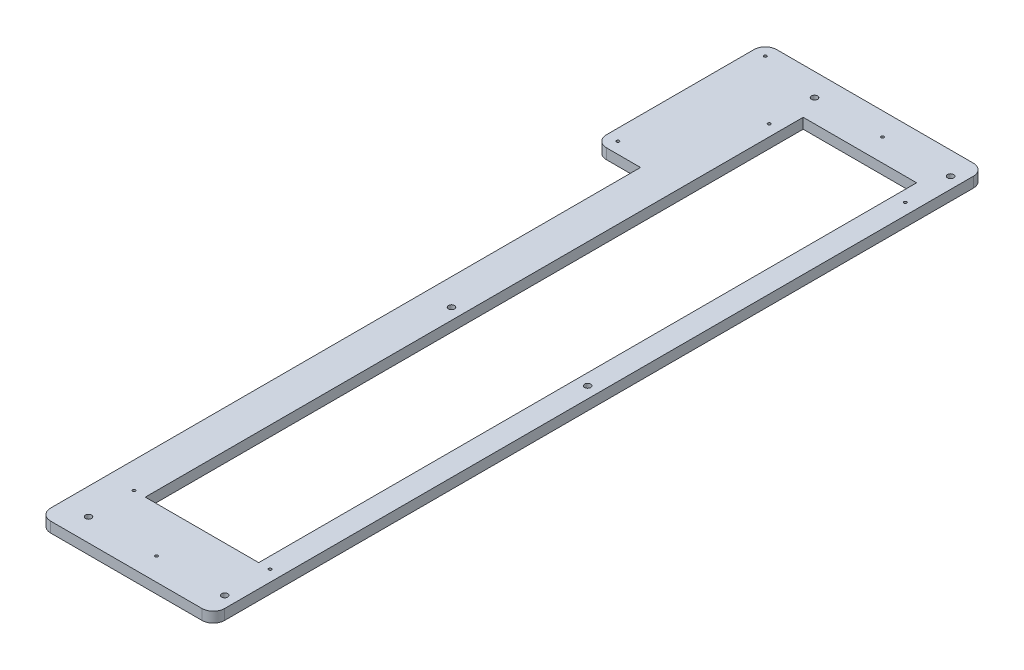
from build123d import *

# Parameters (mm, degrees)
SKETCH1_W            = 88.9
SKETCH1_H            = 431.8
BOSS_EXTRUDE1_DEPTH  = 5.8
M3_CLEARANCE_HOLE1_D = 3.4
SKETCH2_W            = 63.5
SKETCH2_H            = 368.3
CUT_EXTRUDE1_DEPTH   = 441.89464728
SKETCH3_W            = 8.5
SKETCH3_H            = 431.8
BOSS_EXTRUDE2_DEPTH  = 5.8
SKETCH7_R            = 0.79375
CUT_EXTRUDE2_DEPTH   = 443.68684191
SKETCH9_W            = 25.4
SKETCH9_H            = 95.25
BOSS_EXTRUDE3_DEPTH  = 5.8
SKETCH10_R           = 0.79375
CUT_EXTRUDE4_DEPTH   = 449.959597291
FILLET1_R            = 6.35


with BuildPart() as part:
    # Sketch1 → Boss-Extrude1 (new body)
    with BuildSketch(Plane(origin=(0, 0, 0), x_dir=(1, 0, 0), z_dir=(0, 1, 0))):
        with Locations((-44.45, -215.9)):
            Rectangle(SKETCH1_W, SKETCH1_H)
    extrude(amount=BOSS_EXTRUDE1_DEPTH)

    # M3 Clearance Hole1 (through all)
    with Locations(Plane(origin=(0, 5.8, 0), x_dir=(-1, 0, 0), z_dir=(0, 1, 0))):
        with Locations((82.55, 12.7), (6.35, 12.7), (6.35, 419.1), (82.55, 419.1), (82.55, 215.9), (6.35, 215.9)):
            Hole(M3_CLEARANCE_HOLE1_D / 2)

    # Sketch2 → Cut-Extrude1 (cut, through all)
    with BuildSketch(Plane(origin=(0, 5.8, 0), x_dir=(1, 0, 0), z_dir=(0, 1, 0))):
        with Locations((-44.45, -209.55)):
            Rectangle(SKETCH2_W, SKETCH2_H)
    extrude(amount=-CUT_EXTRUDE1_DEPTH, mode=Mode.SUBTRACT)

    # Sketch3 → Boss-Extrude2 (add, through all)
    with BuildSketch(Plane(origin=(0, 5.8, 0), x_dir=(-1, 0, 0), z_dir=(0, 1, 0))):
        with Locations((93.15, 215.9)):
            Rectangle(SKETCH3_W, SKETCH3_H)
    extrude(amount=-BOSS_EXTRUDE2_DEPTH)

    # Sketch7 → Cut-Extrude2 (cut, through all)
    with BuildSketch(Plane(origin=(0, 5.8, 0), x_dir=(1, 0, 0), z_dir=(0, 1, 0))):
        with Locations(Location((-44.45, -12.7, 0), (0, 0, 270))):
            Circle(SKETCH7_R)
        with Locations(Location((-82.55, -38.1, 0), (0, 0, 270))):
            Circle(SKETCH7_R)
        with Locations(Location((-6.35, -38.1, 0), (0, 0, 270))):
            Circle(SKETCH7_R)
        with Locations(Location((-6.35, -393.7, 0), (0, 0, 90))):
            Circle(SKETCH7_R)
        with Locations(Location((-82.55, -393.7, 0), (0, 0, 90))):
            Circle(SKETCH7_R)
        with Locations(Location((-44.45, -419.1, 0), (0, 0, 90))):
            Circle(SKETCH7_R)
    extrude(amount=-CUT_EXTRUDE2_DEPTH, mode=Mode.SUBTRACT)

    # Sketch9 → Boss-Extrude3 (add, through all)
    with BuildSketch(Plane(origin=(0, 5.8, 0), x_dir=(1, 0, 0), z_dir=(0, 1, 0))):
        with Locations((-110.1, -47.625)):
            Rectangle(SKETCH9_W, SKETCH9_H)
    extrude(amount=-BOSS_EXTRUDE3_DEPTH)

    # Sketch10 → Cut-Extrude4 (cut, through all)
    with BuildSketch(Plane(origin=(0, 5.8, 0), x_dir=(1, 0, 0), z_dir=(0, 1, 0))):
        with Locations(Location((-116.45, -88.9, 0), (0, 0, 270))):
            Circle(SKETCH10_R)
        with Locations(Location((-116.45, -6.35, 0), (0, 0, 270))):
            Circle(SKETCH10_R)
    extrude(amount=-CUT_EXTRUDE4_DEPTH, mode=Mode.SUBTRACT)

    # Fillet1
    fillet1_edges = [part.edges().sort_by_distance(p)[0] for p in [
        (0, 2.9, 431.8),
        (-97.4, 2.9, 431.8),
        (-122.8, 2.9, 95.25),
        (0, 2.9, 0),
        (-122.8, 2.9, 0),
    ]]
    fillet(fillet1_edges, radius=FILLET1_R)


solid = part.part
